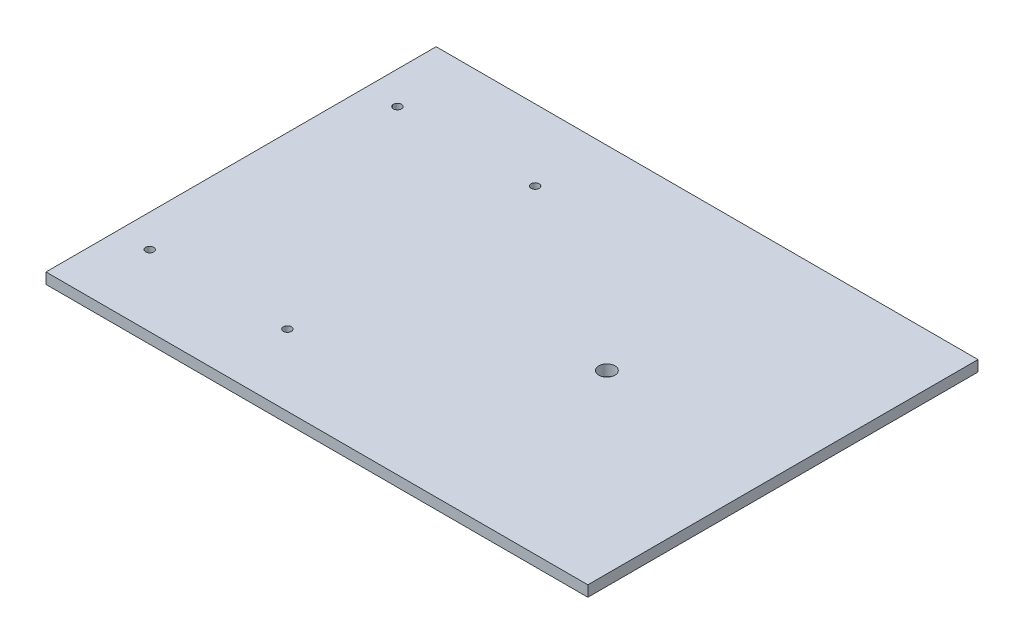
from build123d import *

# Parameters (mm, degrees)
SKETCH1_W           = 200
SKETCH1_H           = 144
BOSS_EXTRUDE1_DEPTH = 4
SKETCH2_R           = 3
SKETCH2_R_2         = 1.491452975
CUT_EXTRUDE1_DEPTH  = 124.288280059


with BuildPart() as part:
    # Sketch1 → Boss-Extrude1 (new body)
    with BuildSketch(Plane(origin=(0, 0, 0), x_dir=(1, 0, 0), z_dir=(0, 1, 0))):
        Rectangle(SKETCH1_W, SKETCH1_H)
    extrude(amount=BOSS_EXTRUDE1_DEPTH)

    # Sketch2 → Cut-Extrude1 (cut, through all)
    with BuildSketch(Plane(origin=(0, 4, 0), x_dir=(1, 0, 0), z_dir=(0, 1, 0))):
        with Locations(Location((35, 0, 0), (0, 0, 270))):
            Circle(SKETCH2_R)
        with Locations(Location((-88, 45.72, 0), (0, 0, 270))):
            Circle(SKETCH2_R_2)
        with Locations(Location((-37.2, 45.72, 0), (0, 0, 270))):
            Circle(SKETCH2_R_2)
        with Locations(Location((-37.2, -45.72, 0), (0, 0, 270))):
            Circle(SKETCH2_R_2)
        with Locations(Location((-88, -45.72, 0), (0, 0, 270))):
            Circle(SKETCH2_R_2)
    extrude(amount=-CUT_EXTRUDE1_DEPTH, mode=Mode.SUBTRACT)


solid = part.part
